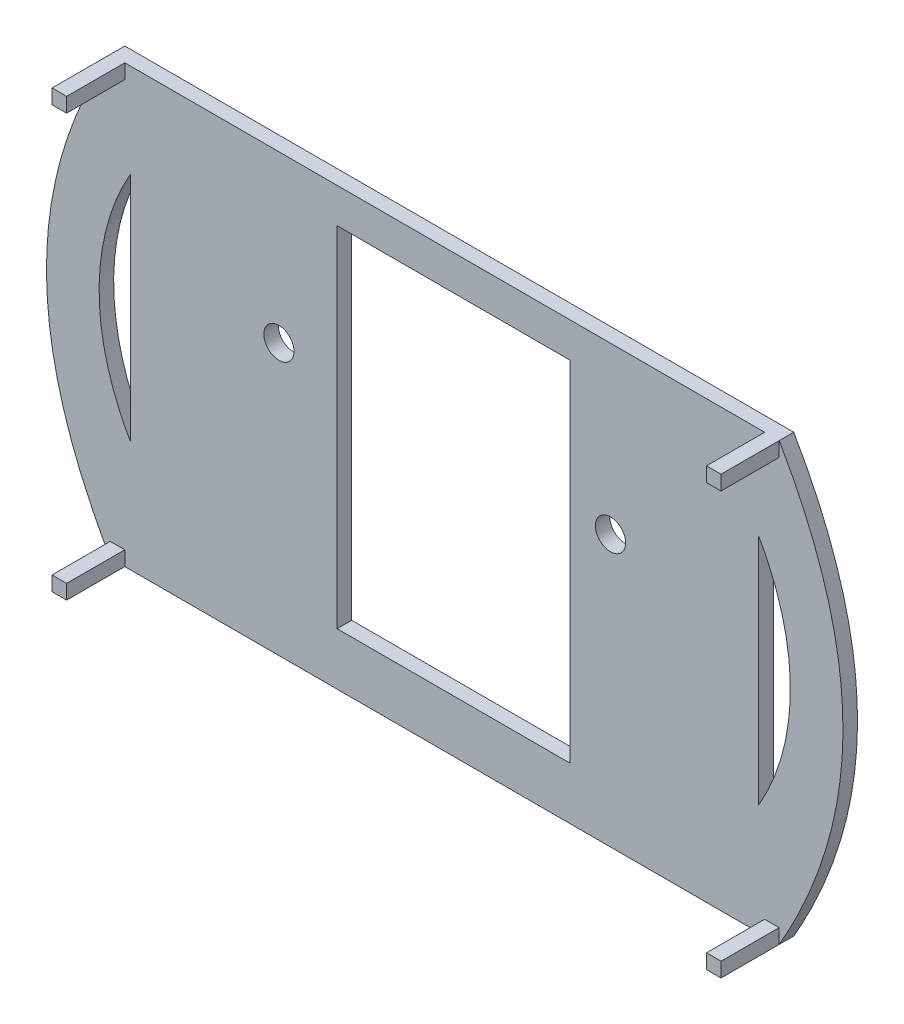
from build123d import *

# Parameters (mm, degrees)
SKETCH1_W           = 73.025
SKETCH1_H           = 95.25
BOSS_EXTRUDE1_DEPTH = 3.175
SKETCH2_R           = 3.302
SKETCH2_W           = 50.8
SKETCH2_H           = 76.2
CUT_EXTRUDE1_DEPTH  = 3.81
SKETCH3_W           = 3.175
SKETCH3_H           = 3.175
BOSS_EXTRUDE2_DEPTH = 12.7


with BuildPart() as part:
    # Sketch1 → Boss-Extrude1 (new body)
    with BuildSketch(Plane.XY):
        with BuildLine():
            Line((-53.549611798, 36.126771133), (-53.549611798, -59.123228867))
            add(Edge.make_bspline(
                [(-53.549611798, 36.126771133), (-70.059671862, 7.530508267), (-74.046742033, -23.621157889), (-53.549611798, -59.123228867)],
                knots=[0, 0, 0, 0, 1, 1, 1, 1], degree=3))
        make_face()
        with Locations((-17.037111798, -11.498228867)):
            Rectangle(SKETCH1_W, SKETCH1_H)
        with Locations((55.987888202, -11.498228867)):
            Rectangle(SKETCH1_W, SKETCH1_H)
        with BuildLine():
            add(Edge.make_bspline(
                [(92.500388202, 36.126771133), (109.010448266, 7.530508267), (112.997518438, -23.621157889), (92.500388202, -59.123228867)],
                knots=[0, 0, 0, 0, 1, 1, 1, 1], degree=3))
            Line((92.500388202, -59.123228867), (92.500388202, 36.126771133))
        make_face()
    extrude(amount=BOSS_EXTRUDE1_DEPTH)

    # Sketch2 → Cut-Extrude1 (cut)
    with BuildSketch(Plane.XY.offset(3.175)):
        with Locations((-16.719611798, 0)):
            Circle(SKETCH2_R)
        with Locations((55.670388202, 0)):
            Circle(SKETCH2_R)
        with Locations((21.380388202, -9.593228867)):
            Rectangle(SKETCH2_W, SKETCH2_H)
        with BuildLine():
            Line((-49.077041311, 15.806771133), (-49.077041311, -34.993228867))
            add(Edge.make_bspline(
                [(-49.077041311, 15.806771133), (-57.589988192, 1.061914612), (-58.955244286, -17.883679426), (-49.077041311, -34.993228867)],
                knots=[0, 0, 0, 0, 1, 1, 1, 1], degree=3))
        make_face()
        with BuildLine():
            Line((88.027817715, 15.806771133), (88.027817715, -34.993228867))
            add(Edge.make_bspline(
                [(88.027817715, 15.806771133), (96.540764597, 1.061914612), (97.90602069, -17.883679426), (88.027817715, -34.993228867)],
                knots=[0, 0, 0, 0, 1, 1, 1, 1], degree=3))
        make_face()
    extrude(amount=-CUT_EXTRUDE1_DEPTH, mode=Mode.SUBTRACT)

    # Sketch3 → Boss-Extrude2 (add)
    with BuildSketch(Plane.XY.offset(3.175)):
        with Locations((-51.962111798, 34.539271133)):
            Rectangle(SKETCH3_W, SKETCH3_H)
        with Locations((-51.962111798, -57.535728867)):
            Rectangle(SKETCH3_W, SKETCH3_H)
        with Locations((90.912888202, -57.535728867)):
            Rectangle(SKETCH3_W, SKETCH3_H)
        with Locations((90.912888202, 34.539271133)):
            Rectangle(SKETCH3_W, SKETCH3_H)
    extrude(amount=BOSS_EXTRUDE2_DEPTH)


solid = part.part
